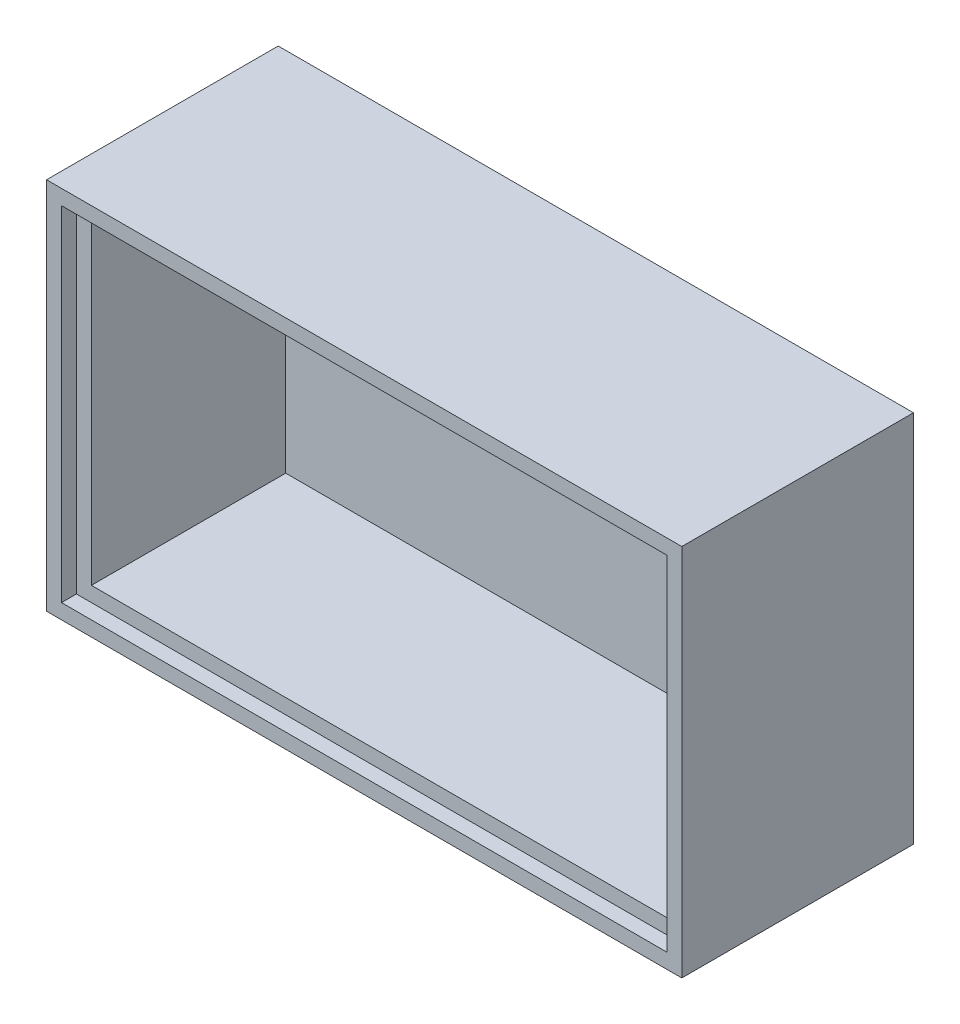
from build123d import *

# Parameters (mm, degrees)
SKICA1_W                = 85
SKICA1_H                = 50
P_IDAT_VYSUNUT_M1_DEPTH = 3
SKICA1_5_W              = 85
SKICA1_5_H              = 50
SKICA1_5_W_2            = 81
SKICA1_5_H_2            = 46
P_IDAT_VYSUNUT_M2_DEPTH = 31
SKICA1_6_W              = 81
SKICA1_6_H              = 46
SKICA1_6_W_2            = 77
SKICA1_6_H_2            = 42
P_IDAT_VYSUNUT_M3_DEPTH = 29


with BuildPart() as part:
    # Skica1 → Přidat vysunutím1 (new body)
    with BuildSketch(Plane.XY):
        with Locations((42.5, 25)):
            Rectangle(SKICA1_W, SKICA1_H)
    extrude(amount=P_IDAT_VYSUNUT_M1_DEPTH)

    # Skica1<5> → Přidat vysunutím2 (add)
    with BuildSketch(Plane.XY):
        with Locations((42.5, 25)):
            Rectangle(SKICA1_5_W, SKICA1_5_H)
        with Locations((42.5, 25)):
            Rectangle(SKICA1_5_W_2, SKICA1_5_H_2, mode=Mode.SUBTRACT)
    extrude(amount=P_IDAT_VYSUNUT_M2_DEPTH)

    # Skica1<6> → Přidat vysunutím3 (add)
    with BuildSketch(Plane.XY):
        with Locations((42.5, 25)):
            Rectangle(SKICA1_6_W, SKICA1_6_H)
        with Locations((42.5, 25)):
            Rectangle(SKICA1_6_W_2, SKICA1_6_H_2, mode=Mode.SUBTRACT)
    extrude(amount=P_IDAT_VYSUNUT_M3_DEPTH)


solid = part.part
